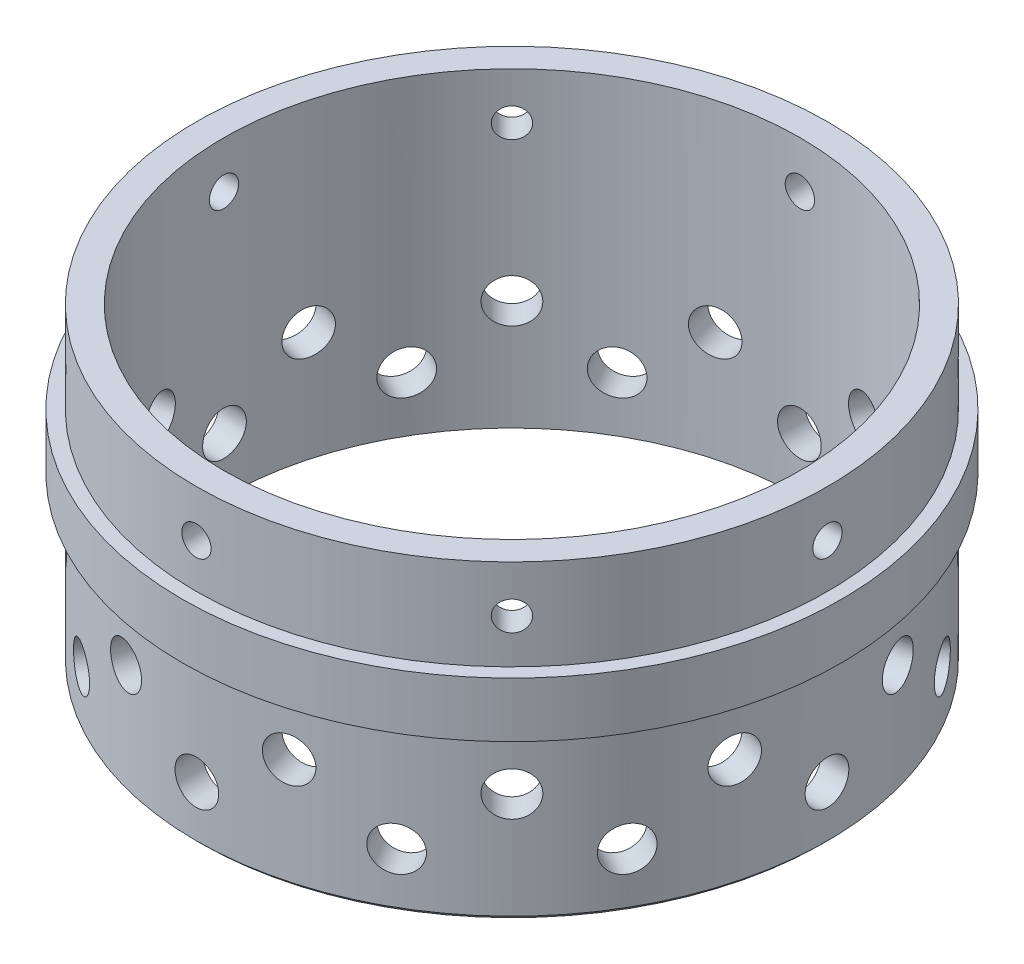
from build123d import *

# Parameters (mm, degrees)
SKETCH1_R           = 76.0095
SKETCH1_R_2         = 66.4845
BOSS_EXTRUDE1_DEPTH = 12.7
BOSS_EXTRUDE2_START = -38.1
SKETCH1_3_R         = 72.8345
SKETCH1_3_R_2       = 66.4845
BOSS_EXTRUDE2_DEPTH = 38.1
SKETCH1_4_R         = 72.8345
SKETCH1_4_R_2       = 66.4845
BOSS_EXTRUDE3_DEPTH = 33.655
CHAMFER1_SIZE       = 1
SKETCH2_R           = 5.0419
CUT_EXTRUDE1_DEPTH  = 115.046035356
SKETCH3_R           = 5.0419
CUT_EXTRUDE2_DEPTH  = 38.1
CIRPATTERN2_COUNT   = 12
SKETCH2_3_R         = 3.3782
CUT_EXTRUDE3_DEPTH  = 115.04603539
CIRPATTERN3_COUNT   = 8


with BuildPart() as part:
    # Sketch1 → Boss-Extrude1 (new body)
    with BuildSketch(Plane(origin=(0, 0, 0), x_dir=(1, 0, 0), z_dir=(0, 1, 0))):
        Circle(SKETCH1_R)
        Circle(SKETCH1_R_2, mode=Mode.SUBTRACT)
    extrude(amount=BOSS_EXTRUDE1_DEPTH)

    # Sketch1<3> → Boss-Extrude2 (add)
    with BuildSketch(Plane(origin=(0, 0, 0), x_dir=(1, 0, 0), z_dir=(0, 1, 0)).offset(BOSS_EXTRUDE2_START)):
        Circle(SKETCH1_3_R)
        Circle(SKETCH1_3_R_2, mode=Mode.SUBTRACT)
    extrude(amount=BOSS_EXTRUDE2_DEPTH)

    # Sketch1<4> → Boss-Extrude3 (add)
    with BuildSketch(Plane(origin=(0, 0, 0), x_dir=(1, 0, 0), z_dir=(0, 1, 0))):
        Circle(SKETCH1_4_R)
        Circle(SKETCH1_4_R_2, mode=Mode.SUBTRACT)
    extrude(amount=BOSS_EXTRUDE3_DEPTH)

    # Chamfer1
    chamfer1_edges = [part.edges().sort_by_distance(p)[0] for p in [
        (-72.8345, -38.1, 0),
    ]]
    chamfer(chamfer1_edges, length=CHAMFER1_SIZE)

    # Sketch2 → Cut-Extrude1 (cut, through all)
    with BuildSketch(Plane.XY):
        with Locations((0, -25.4)):
            Circle(SKETCH2_R)
    cut_extrude1 = extrude(amount=-CUT_EXTRUDE1_DEPTH, mode=Mode.SUBTRACT)

    # Sketch3 → Cut-Extrude2 (cut)
    with BuildSketch(Plane(origin=(-19.672706209, 0, 73.419539093), x_dir=(0, -1, 0), z_dir=(-0.25881904510252135, 0, 0.9659258262890681))):
        with Locations((12.7, 0)):
            Circle(SKETCH3_R)
    cut_extrude2 = extrude(amount=-CUT_EXTRUDE2_DEPTH, mode=Mode.SUBTRACT)

    # CirPattern2: Cut-Extrude1, Cut-Extrude2 ×12 about axis
    cirpattern2_axis = Axis((0, 0, 0), (0, 1, 0))
    add([cut_extrude1.rotate(cirpattern2_axis, i * 360 / CIRPATTERN2_COUNT) for i in range(1, CIRPATTERN2_COUNT)], mode=Mode.SUBTRACT)
    add([cut_extrude2.rotate(cirpattern2_axis, i * 360 / CIRPATTERN2_COUNT) for i in range(1, CIRPATTERN2_COUNT)], mode=Mode.SUBTRACT)

    # Sketch2<3> → Cut-Extrude3 (cut, through all)
    with BuildSketch(Plane.XY):
        with Locations((0, 22.86)):
            Circle(SKETCH2_3_R)
    cut_extrude3 = extrude(amount=-CUT_EXTRUDE3_DEPTH, mode=Mode.SUBTRACT)

    # CirPattern3: Cut-Extrude3 ×8 about axis
    cirpattern3_axis = Axis((0, 12.7, 0), (0, -1, 0))
    for i in range(1, CIRPATTERN3_COUNT):
        add(cut_extrude3.rotate(cirpattern3_axis, i * 360 / CIRPATTERN3_COUNT), mode=Mode.SUBTRACT)


solid = part.part
